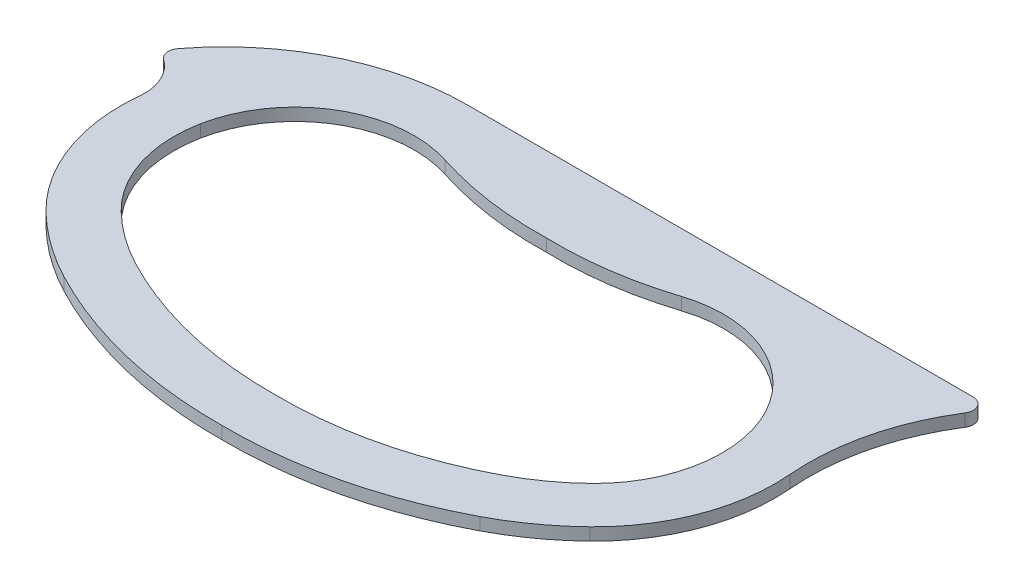
from build123d import *

# Parameters (mm, degrees)
BOSS_EXTRUDE1_DEPTH = 3


with BuildPart() as part:
    # Sketch1 → Boss-Extrude1 (new body)
    with BuildSketch(Plane(origin=(0, 0, 0), x_dir=(1, 0, 0), z_dir=(0, 1, 0))):
        with BuildLine():
            Line((-31.744728966, 17.146847669), (90.112594835, 17.146847669))
            ThreePointArc((90.112594835, 17.146847669), (92.565620931, 15.696908028), (92.478118614, 12.848749793))
            ThreePointArc((92.478118614, 12.848749793), (85.55789243, -3.426446533), (84.197045341, -21.059360105))
            ThreePointArc((84.197045341, -21.059360105), (81.584356476, -40.056839396), (71.059546267, -56.086771791))
            ThreePointArc((71.059546267, -56.086771791), (63.736401413, -62.212035121), (55.619101507, -67.237643905))
            ThreePointArc((55.619101507, -67.237643905), (31.315398674, -76.373966348), (5.514443068, -79.281379121))
            ThreePointArc((5.514443068, -79.281379121), (-20.286512537, -76.373966348), (-44.59021537, -67.237643905))
            ThreePointArc((-44.59021537, -67.237643905), (-52.707515276, -62.212035121), (-60.03066013, -56.086771791))
            ThreePointArc((-60.03066013, -56.086771791), (-70.666595812, -39.757213537), (-73.108914698, -20.422977605))
            ThreePointArc((-73.108914698, -20.422977605), (-74.05774513, -14.573171652), (-77.796738294, -9.975298341))
            ThreePointArc((-77.796738294, -9.975298341), (-78.92336426, -8.119267018), (-78.384627262, -6.015959912))
            ThreePointArc((-78.384627262, -6.015959912), (-57.78218164, 11.037323217), (-31.744728966, 17.146847669))
        make_face()
        with BuildLine():
            ThreePointArc((5.514443068, -1.081998552), (19.929462064, -0.256796987), (34.001578397, 2.975736417))
            ThreePointArc((34.001578397, 2.975736417), (57.41708067, 0.337527336), (70.993213533, -18.922132846))
            ThreePointArc((70.993213533, -18.922132846), (70.131692962, -34.019755233), (62.170548913, -46.876683515))
            ThreePointArc((62.170548913, -46.876683515), (56.242369759, -51.835162299), (49.671311961, -55.903456704))
            ThreePointArc((49.671311961, -55.903456704), (28.252463685, -63.945588922), (5.514443068, -66.480420375))
            ThreePointArc((5.514443068, -66.480420375), (-17.223577548, -63.945588922), (-38.642425824, -55.903456704))
            ThreePointArc((-38.642425824, -55.903456704), (-45.213483622, -51.835162299), (-51.141662776, -46.876683515))
            ThreePointArc((-51.141662776, -46.876683515), (-59.102806825, -34.019755233), (-59.964327396, -18.922132846))
            ThreePointArc((-59.964327396, -18.922132846), (-46.388194533, 0.337527336), (-22.97269226, 2.975736417))
            ThreePointArc((-22.97269226, 2.975736417), (-8.900575928, -0.256796987), (5.514443068, -1.081998552))
        make_face(mode=Mode.SUBTRACT)
    extrude(amount=BOSS_EXTRUDE1_DEPTH)


solid = part.part
